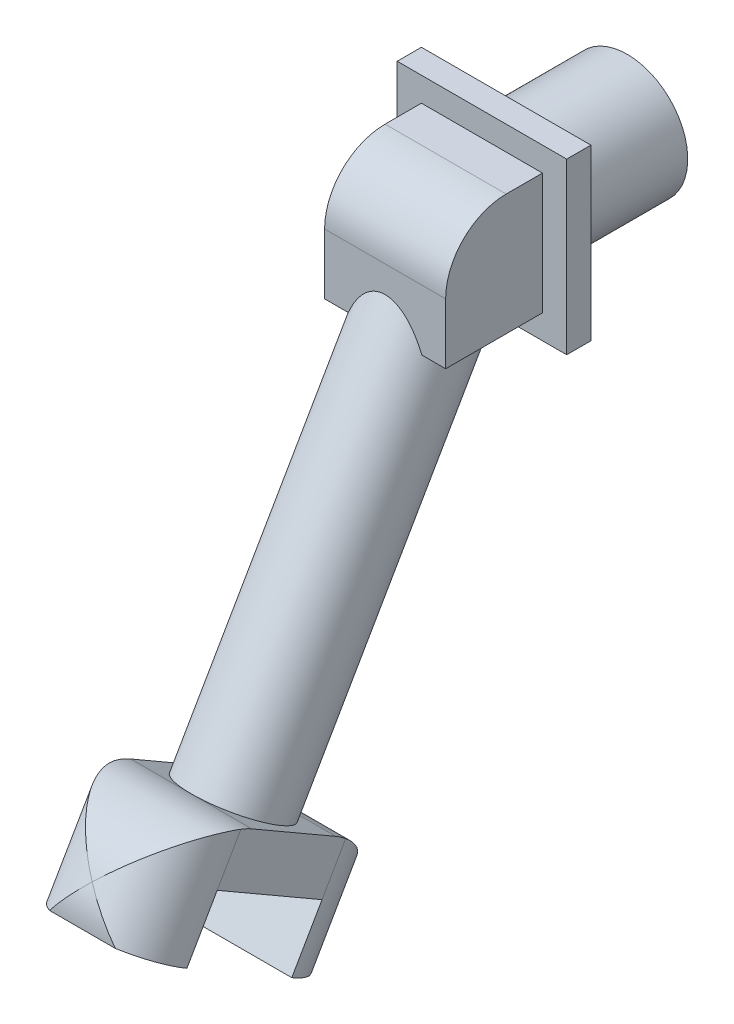
from build123d import *

# Parameters (mm, degrees)
SKETCH1_W           = 10
SKETCH1_H           = 10
BOSS_EXTRUDE1_DEPTH = 10
SKETCH2_R           = 5
BOSS_EXTRUDE2_DEPTH = 10
SKETCH4_R           = 4
BOSS_EXTRUDE3_DEPTH = 40
BOSS_EXTRUDE4_DEPTH = 10
CUT_EXTRUDE1_DEPTH  = 10
FILLET2_R           = 5
SKETCH7_W           = 14
SKETCH7_H           = 14
BOSS_EXTRUDE5_DEPTH = 2


with BuildPart() as part:
    # Sketch1 → Boss-Extrude1 (new body)
    with BuildSketch(Plane(origin=(0, 0, 0), x_dir=(1, 0, 0), z_dir=(0, 1, 0))):
        with Locations((5, 5)):
            Rectangle(SKETCH1_W, SKETCH1_H)
    extrude(amount=BOSS_EXTRUDE1_DEPTH)

    # Sketch2 → Boss-Extrude2 (add)
    with BuildSketch(Plane(origin=(0, 0, -10), x_dir=(-1, 0, 0), z_dir=(0, 0, -1))):
        with Locations((-5, 5)):
            Circle(SKETCH2_R)
    extrude(amount=BOSS_EXTRUDE2_DEPTH)

    # Sketch4 → Boss-Extrude3 (add)
    with BuildSketch(Plane(origin=(9.62e-07, 9.026239035, -5.211301537), x_dir=(0, -0.49999999999999467, -0.8660254037844417), z_dir=(-9.225892847871432e-08, -0.8660254037844382, 0.4999999999999926))):
        with Locations(Location((2.59569937, 4.999999038, 0), (0, 0, 229.539411428))):
            Circle(SKETCH4_R)
    extrude(amount=BOSS_EXTRUDE3_DEPTH)

    # Sketch5 → Boss-Extrude4 (add)
    with BuildSketch(Plane(origin=(0, 0, 0), x_dir=(0, 0, -1), z_dir=(1, 0, 0))):
        with BuildLine():
            Line((-16.004858714, -24.912627201), (-9.076655484, -28.912627201))
            ThreePointArc((-9.076655484, -28.912627201), (-6.076655484, -34.108779624), (-9.076655484, -39.304932046))
            Line((-9.076655484, -39.304932046), (-12.71063008, -37.206855835))
            Line((-12.71063008, -37.206855835), (-10.21063008, -32.876728816))
            Line((-10.21063008, -32.876728816), (-18.870884118, -27.876728816))
            Line((-18.870884118, -27.876728816), (-21.370884118, -32.206855835))
            Line((-21.370884118, -32.206855835), (-25.004858714, -30.108779624))
            ThreePointArc((-25.004858714, -30.108779624), (-22.004858714, -24.912627201), (-16.004858714, -24.912627201))
        make_face()
    extrude(amount=BOSS_EXTRUDE4_DEPTH)

    # Sketch6 → Cut-Extrude1 (cut)
    with BuildSketch(Plane(origin=(0, -33.40900615, 19.288698694), x_dir=(-1, 0, 0), z_dir=(0, -0.8660254037844403, 0.4999999999999971))):
        with BuildLine():
            Line((0, -7.40430063), (0, -2.40430063))
            ThreePointArc((0, -2.40430063), (-1.464466094, -5.939834536), (-5, -7.40430063))
            Line((-5, -7.40430063), (0, -7.40430063))
        make_face()
        with BuildLine():
            Line((-10, -7.40430063), (-5, -7.40430063))
            ThreePointArc((-5, -7.40430063), (-8.535533906, -5.939834536), (-10, -2.40430063))
            Line((-10, -2.40430063), (-10, -7.40430063))
        make_face()
        with BuildLine():
            ThreePointArc((-7.718879336, 11.791851793), (-6.417610293, 12.390527944), (-5, 12.59569937))
            Line((-5, 12.59569937), (-10, 12.59569937))
            Line((-10, 12.59569937), (-10, 11.791851793))
            Line((-10, 11.791851793), (-7.718879336, 11.791851793))
        make_face()
        with BuildLine():
            ThreePointArc((-10, 7.59569937), (-9.392857651, 9.983753318), (-7.718879336, 11.791851793))
            Line((-7.718879336, 11.791851793), (-10, 11.791851793))
            Line((-10, 11.791851793), (-10, 7.59569937))
        make_face()
        with BuildLine():
            Line((-2.281120664, 11.791851793), (0, 11.791851793))
            Line((0, 11.791851793), (0, 12.59569937))
            Line((0, 12.59569937), (-5, 12.59569937))
            ThreePointArc((-5, 12.59569937), (-3.582389707, 12.390527944), (-2.281120664, 11.791851793))
        make_face()
        with BuildLine():
            ThreePointArc((-2.281120664, 11.791851793), (-0.607142349, 9.983753318), (0, 7.59569937))
            Line((0, 7.59569937), (0, 11.791851793))
            Line((0, 11.791851793), (-2.281120664, 11.791851793))
        make_face()
    extrude(amount=-CUT_EXTRUDE1_DEPTH, mode=Mode.SUBTRACT)

    # Fillet2
    fillet2_edges = [part.edges().sort_by_distance(p)[0] for p in [
        (5, 10, 0),
    ]]
    fillet(fillet2_edges, radius=FILLET2_R)

    # Sketch7 → Boss-Extrude5 (add)
    with BuildSketch(Plane(origin=(0, 0, -10), x_dir=(-1, 0, 0), z_dir=(0, 0, -1))):
        with Locations((-5, 5)):
            Rectangle(SKETCH7_W, SKETCH7_H)
    extrude(amount=-BOSS_EXTRUDE5_DEPTH)


solid = part.part
